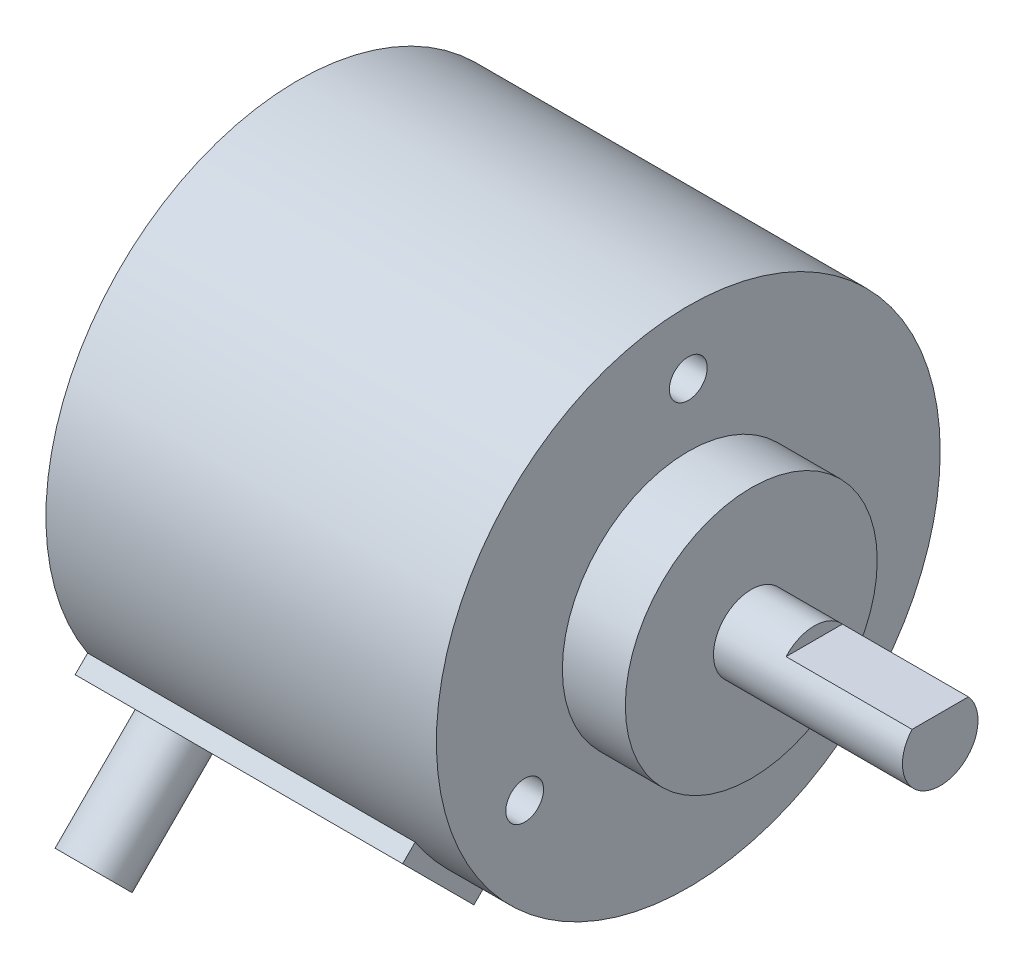
from build123d import *
from build123d.topology import SkipClean

# Parameters (mm, degrees)
SKETCH_1_R                       = 20
EXTRUDE_1_DEPTH                  = 5
SKETCH_2_R                       = 10
EXTRUDE_2_DEPTH                  = 5
SKETCH_3_R                       = 1.5
CUT_EXTRUDE_1_DEPTH              = 5
SKETCH_4_R                       = 3
EXTRUDE_3_DEPTH                  = 5
EXTRUDE_4_DEPTH                  = 10
EXTRUDE_START                    = 26
SKETCH_6_R                       = 20
EXTRUDE_5_DEPTH                  = 26
SKETCH_8_R                       = 2.5
EXTRUDE_6_DEPTH                  = 10
EXTRUDE_6_DIRECTION_2_REACH      = 56.84
EXTRUDE_6_DIRECTION_2_END_RADIUS = 20
SKETCH_9_W                       = 26
SKETCH_9_H                       = 8
EXTRUDE_7_DEPTH                  = 1
EXTRUDE_7_DIRECTION_2_REACH      = 56.84
EXTRUDE_7_DIRECTION_2_END_RADIUS = 20


with BuildPart() as part:
    # Эскиз1 → Бобышка-Вытянуть1 (new body)
    with BuildSketch(Plane(origin=(0, 0, 0), x_dir=(0, 0, -1), z_dir=(1, 0, 0))):
        Circle(SKETCH_1_R)
    extrude(amount=EXTRUDE_1_DEPTH)

    # Эскиз2 → Бобышка-Вытянуть2 (add)
    with BuildSketch(Plane(origin=(5, 0, 0), x_dir=(0, 0, -1), z_dir=(1, 0, 0))):
        Circle(SKETCH_2_R)
    extrude(amount=EXTRUDE_2_DEPTH)

    # Эскиз3 → Вырез-Вытянуть1 (cut)
    with BuildSketch(Plane(origin=(5, 0, 0), x_dir=(0, 0, -1), z_dir=(1, 0, 0))):
        with Locations((0, 15)):
            Circle(SKETCH_3_R)
        with Locations((12.990381057, -7.5)):
            Circle(SKETCH_3_R)
        with Locations((-12.990381057, -7.5)):
            Circle(SKETCH_3_R)
    extrude(amount=-CUT_EXTRUDE_1_DEPTH, mode=Mode.SUBTRACT)

    # Эскиз4 → Бобышка-Вытянуть3 (add)
    with BuildSketch(Plane(origin=(10, 0, 0), x_dir=(0, 0, -1), z_dir=(1, 0, 0))):
        Circle(SKETCH_4_R)
    extrude(amount=EXTRUDE_3_DEPTH)

    # Эскиз5 → Бобышка-Вытянуть4 (add)
    with BuildSketch(Plane(origin=(15, 0, 0), x_dir=(0, 0, -1), z_dir=(1, 0, 0))):
        with BuildLine():
            Line((-2.236067977, 2), (2.236067977, 2))
            ThreePointArc((2.236067977, 2), (0, -3), (-2.236067977, 2))
        make_face()
    extrude(amount=EXTRUDE_4_DEPTH)

    # Эскиз6 → Бобышка-Вытянуть5 (add)
    with BuildSketch(Plane.ZY.offset(EXTRUDE_START)):
        Circle(SKETCH_6_R)
    extrude(amount=-EXTRUDE_5_DEPTH)

    # Эскиз8 → Бобышка-Вытянуть6 (add)
    with BuildSketch(Plane(origin=(0, -14.142135624, 14.142135624), x_dir=(-1, 0, 0), z_dir=(0, -0.7071067811865511, 0.707106781186544))):
        with Locations(Location((21, 0, 0), (0, 0, 270))):
            Circle(SKETCH_8_R)
    extrude(amount=EXTRUDE_6_DEPTH)

    # Бобышка-Вытянуть6 direction 2: up to this cylinder (the profile starts outside it)
    with SkipClean():  # the faces are left unmerged after this step: merging them gives an invalid solid
        extrude_6_direction_2_end = Plane(origin=(-21, 0, 0), z_dir=(-1, 0, 0)) * Cylinder(EXTRUDE_6_DIRECTION_2_END_RADIUS, 154.68, mode=Mode.PRIVATE)
        # Эскиз8 → Бобышка-Вытянуть6 direction 2 (add, up to the surface)
        with BuildSketch(Plane(origin=(0, -14.142135624, 14.142135624), x_dir=(-1, 0, 0), z_dir=(0, -0.7071067811865511, 0.707106781186544)), mode=Mode.PRIVATE) as extrude_6_direction_2_sk1:
            with Locations(Location((21, 0, 0), (0, 0, 270))):
                Circle(SKETCH_8_R)
        extrude_6_direction_2_tool1 = extrude(extrude_6_direction_2_sk1.sketch, amount=-EXTRUDE_6_DIRECTION_2_REACH, mode=Mode.PRIVATE) - extrude_6_direction_2_end
        add(extrude_6_direction_2_tool1.solids().sort_by_distance((-21, -14.142136, 14.142136))[0])
        add(extrude_6_direction_2_tool1.solids().sort_by_distance((-21, -14.142136, 14.142136))[1])

    # Эскиз9 → Бобышка-Вытянуть7 (add)
    with SkipClean():  # the faces are left unmerged after this step: merging them gives an invalid solid
        with BuildSketch(Plane(origin=(0, -14.142135624, 14.142135624), x_dir=(-1, 0, 0), z_dir=(0, -0.7071067811865511, 0.707106781186544))):
            with Locations((13, 0)):
                Rectangle(SKETCH_9_W, SKETCH_9_H)
        extrude(amount=EXTRUDE_7_DEPTH)

    # Бобышка-Вытянуть7 direction 2: up to this cylinder (the profile starts outside it)
    with SkipClean():  # the faces are left unmerged after this step: merging them gives an invalid solid
        extrude_7_direction_2_end = Plane(origin=(-13, 0, 0), z_dir=(-1, 0, 0)) * Cylinder(EXTRUDE_7_DIRECTION_2_END_RADIUS, 154.68, mode=Mode.PRIVATE)
        # Эскиз9 → Бобышка-Вытянуть7 direction 2 (add, up to the surface)
        with BuildSketch(Plane(origin=(0, -14.142135624, 14.142135624), x_dir=(-1, 0, 0), z_dir=(0, -0.7071067811865511, 0.707106781186544)), mode=Mode.PRIVATE) as extrude_7_direction_2_sk1:
            with Locations((13, 0)):
                Rectangle(SKETCH_9_W, SKETCH_9_H)
        extrude_7_direction_2_tool1 = extrude(extrude_7_direction_2_sk1.sketch, amount=-EXTRUDE_7_DIRECTION_2_REACH, mode=Mode.PRIVATE) - extrude_7_direction_2_end
        add(extrude_7_direction_2_tool1.solids().sort_by_distance((-13, -14.142136, 14.142136))[0])
        add(extrude_7_direction_2_tool1.solids().sort_by_distance((-13, -14.142136, 14.142136))[1])


solid = part.part
